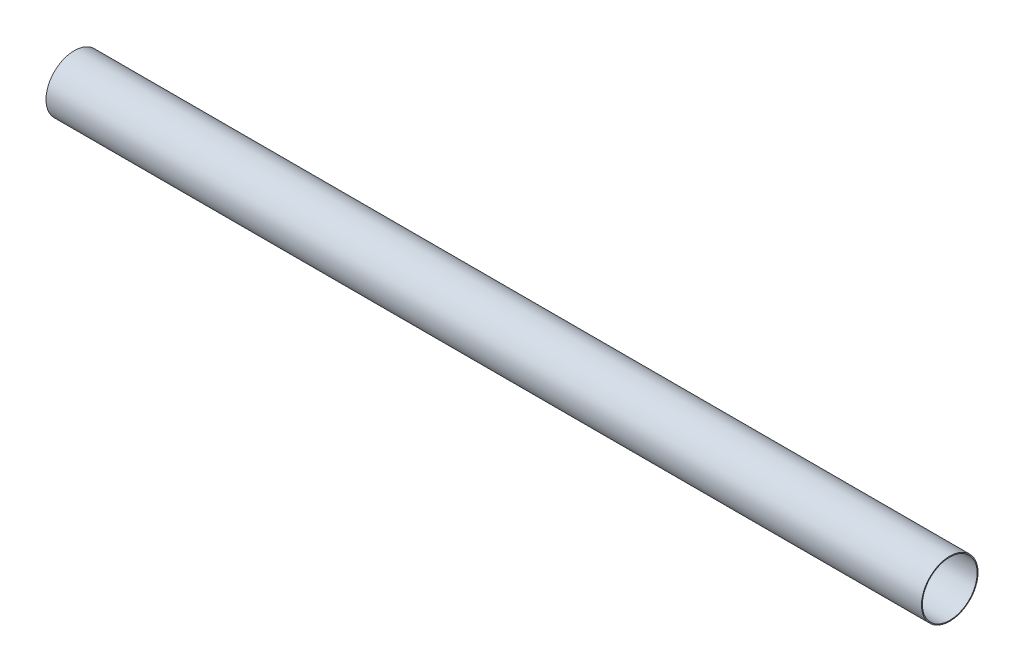
from build123d import *

# Parameters (mm, degrees)
SKETCH3_R           = 78.74
SKETCH3_R_2         = 76.2
EXTRUDE_THIN1_DEPTH = 2438.4


with BuildPart() as part:
    # Sketch3 → Extrude-Thin1 (new body)
    with BuildSketch(Plane(origin=(0, 0, 0), x_dir=(0, 0, -1), z_dir=(1, 0, 0))):
        Circle(SKETCH3_R)
        Circle(SKETCH3_R_2, mode=Mode.SUBTRACT)
    extrude(amount=EXTRUDE_THIN1_DEPTH)


solid = part.part
